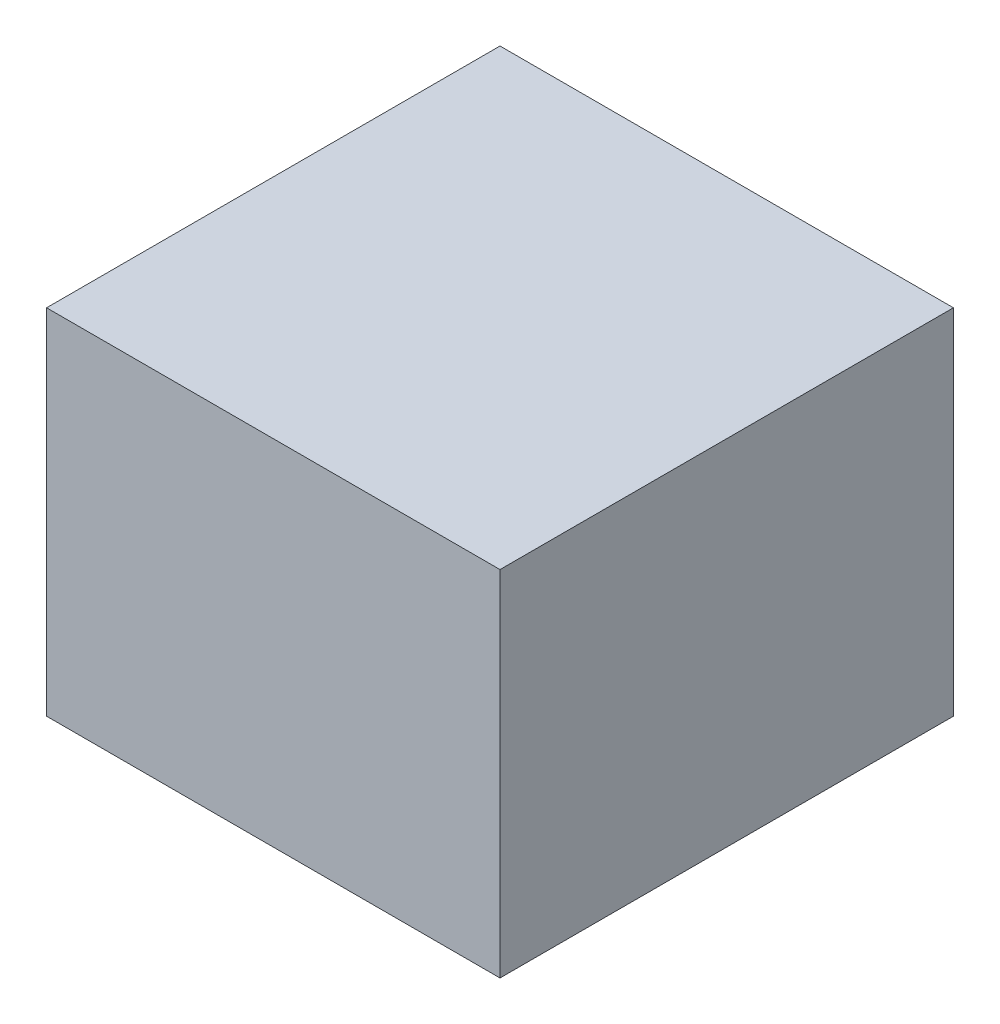
from build123d import *

# Parameters (mm, degrees)
SKETCH1_W                          = 42.3
SKETCH1_H                          = 42.3
BOSS_EXTRUDE1_DEPTH                = 33
SKETCH2_R                          = 2.5
BOSS_EXTRUDE3_DEPTH                = 18
HOLE_FOR_M3_300_SC_NUTS_SP_2_D     = 4.22
HOLE_FOR_M3_300_SC_NUTS_SP_2_DEPTH = 4.5
HOLE_FOR_M3_300_SC_NUTS_SP_2_TIP   = 1.267815906
SKETCH5_R                          = 11
BOSS_EXTRUDE4_DEPTH                = 2


with BuildPart() as part:
    # Sketch1 → Boss-Extrude1 (new body)
    with BuildSketch(Plane(origin=(0, 0, 0), x_dir=(1, 0, 0), z_dir=(0, 1, 0))):
        with Locations((21.15, 21.15)):
            Rectangle(SKETCH1_W, SKETCH1_H)
    extrude(amount=BOSS_EXTRUDE1_DEPTH)

    # Sketch2 → Boss-Extrude3 (add)
    with BuildSketch(Plane(origin=(0, 0, 0), x_dir=(-1, 0, 0), z_dir=(0, -1, 0))):
        with Locations(Location((-21.15, 21.15, 0), (0, 0, 270))):
            Circle(SKETCH2_R)
    extrude(amount=BOSS_EXTRUDE3_DEPTH)

    # Hole for M3 300® SC Nuts (SP)2
    with Locations(Plane(origin=(0, 0, 0), x_dir=(-1, 0, 0), z_dir=(0, -1, 0))):
        with Locations((-5.65, 36.65), (-5.65, 5.65), (-36.65, 5.65), (-36.65, 36.65)):
            Hole(HOLE_FOR_M3_300_SC_NUTS_SP_2_D / 2, depth=HOLE_FOR_M3_300_SC_NUTS_SP_2_DEPTH)
            with Locations((0, 0, -(HOLE_FOR_M3_300_SC_NUTS_SP_2_DEPTH + HOLE_FOR_M3_300_SC_NUTS_SP_2_TIP / 2))):  # 118° drill point
                Cone(0, HOLE_FOR_M3_300_SC_NUTS_SP_2_D / 2, HOLE_FOR_M3_300_SC_NUTS_SP_2_TIP, mode=Mode.SUBTRACT)

    # Sketch5 → Boss-Extrude4 (add)
    with BuildSketch(Plane(origin=(0, 0, 0), x_dir=(1, 0, 0), z_dir=(0, 1, 0))):
        with Locations(Location((21.15, 21.15, 0), (0, 0, 270))):
            Circle(SKETCH5_R)
    extrude(amount=-BOSS_EXTRUDE4_DEPTH)


solid = part.part
